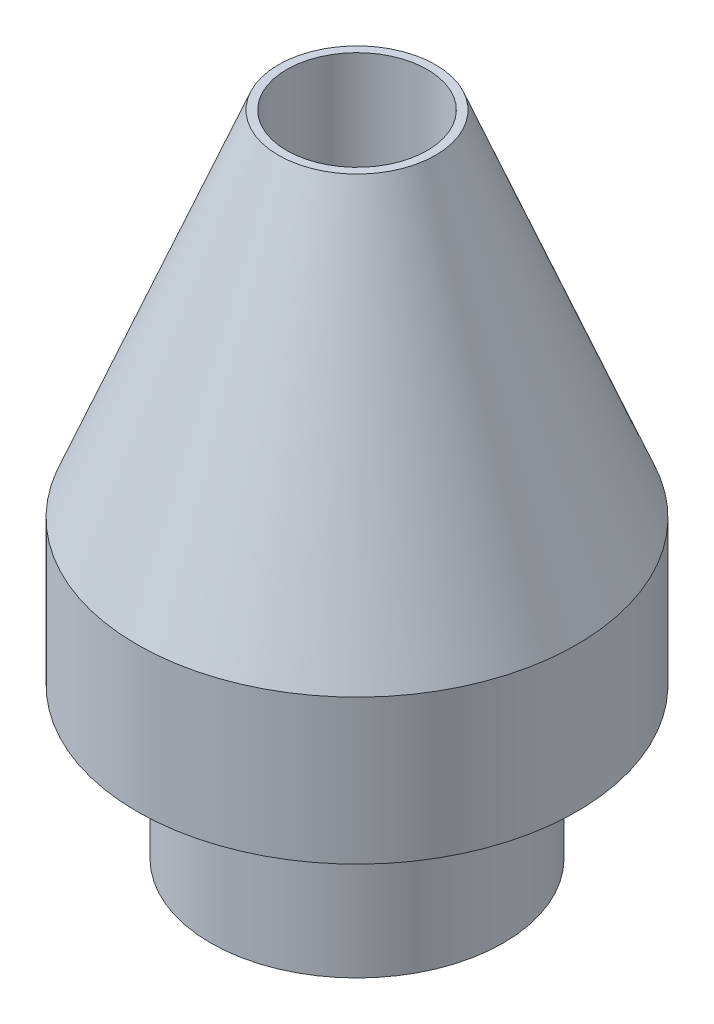
from build123d import *

# Parameters (mm, degrees)
SKETCH1_R           = 6.2992
BOSS_EXTRUDE1_DEPTH = 6.477
SKETCH2_R           = 9.4615
BOSS_EXTRUDE2_DEPTH = 6.223
SKETCH5_R           = 9.4615
SKETCH6_R           = 3.3782
SKETCH7_R           = 3.0226
CUT_EXTRUDE1_DEPTH  = 31.932950796


with BuildPart() as part:
    # Sketch1 → Boss-Extrude1 (new body)
    with BuildSketch(Plane(origin=(0, 0, 0), x_dir=(1, 0, 0), z_dir=(0, 1, 0))):
        with Locations(Location((0, 0, 0), (0, 0, 270))):
            Circle(SKETCH1_R)
    extrude(amount=BOSS_EXTRUDE1_DEPTH)

    # Sketch2 → Boss-Extrude2 (add)
    with BuildSketch(Plane(origin=(0, 6.477, 0), x_dir=(1, 0, 0), z_dir=(0, 1, 0))):
        with Locations(Location((0, 0, 0), (0, 0, 270))):
            Circle(SKETCH2_R)
    extrude(amount=BOSS_EXTRUDE2_DEPTH)

    # Sketch5 → Loft2 section 0
    with BuildSketch(Plane(origin=(0, 12.7, 0), x_dir=(1, 0, 0), z_dir=(0, 1, 0))):
        Circle(SKETCH5_R)
    # Sketch6 → Loft2 section 1
    with BuildSketch(Plane(origin=(0, 27.8892, 0), x_dir=(1, 0, 0), z_dir=(0, 1, 0))):
        Circle(SKETCH6_R)
    loft()

    # Sketch7 → Cut-Extrude1 (cut, through all)
    with BuildSketch(Plane(origin=(0, 27.8892, 0), x_dir=(1, 0, 0), z_dir=(0, 1, 0))):
        with Locations(Location((0, 0, 0), (0, 0, 270))):
            Circle(SKETCH7_R)
    extrude(amount=-CUT_EXTRUDE1_DEPTH, mode=Mode.SUBTRACT)


solid = part.part
